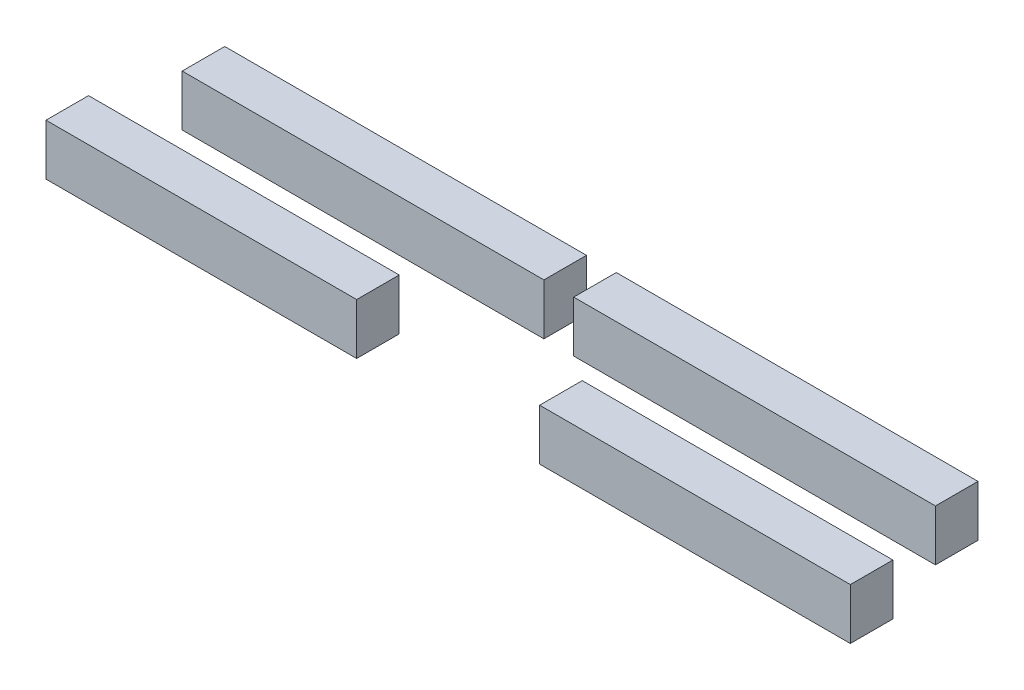
from build123d import *

# Parameters (mm, degrees)
SKETCH1_W             = 36.5
SKETCH1_H             = 5
BOSS_EXTRUDE1_DEPTH   = 6
BOSS_EXTRUDE1_2_DEPTH = 6
SKETCH1_W_2           = 42.5
BOSS_EXTRUDE1_3_DEPTH = 6
BOSS_EXTRUDE1_4_DEPTH = 6


with BuildPart() as part:
    # Sketch1 → Boss-Extrude1 (new body)
    with BuildSketch(Plane(origin=(0, 0, 0), x_dir=(1, 0, 0), z_dir=(0, 1, 0))):
        with Locations((79, 7)):
            Rectangle(SKETCH1_W, SKETCH1_H)
    extrude(amount=BOSS_EXTRUDE1_DEPTH)


with BuildPart() as body_2:
    # Sketch1 → Boss-Extrude1 2 (new body)
    with BuildSketch(Plane(origin=(0, 0, 0), x_dir=(1, 0, 0), z_dir=(0, 1, 0))):
        with Locations((21, 7)):
            Rectangle(SKETCH1_W, SKETCH1_H)
    extrude(amount=BOSS_EXTRUDE1_2_DEPTH)


with BuildPart() as body_3:
    # Sketch1 → Boss-Extrude1 3 (new body)
    with BuildSketch(Plane(origin=(0, 0, 0), x_dir=(1, 0, 0), z_dir=(0, 1, 0))):
        with Locations((73, 20)):
            Rectangle(SKETCH1_W_2, SKETCH1_H)
    extrude(amount=BOSS_EXTRUDE1_3_DEPTH)


with BuildPart() as body_4:
    # Sketch1 → Boss-Extrude1 4 (new body)
    with BuildSketch(Plane(origin=(0, 0, 0), x_dir=(1, 0, 0), z_dir=(0, 1, 0))):
        with Locations((27, 20)):
            Rectangle(SKETCH1_W_2, SKETCH1_H)
    extrude(amount=BOSS_EXTRUDE1_4_DEPTH)


solid = Compound([part.part, body_2.part, body_3.part, body_4.part])
